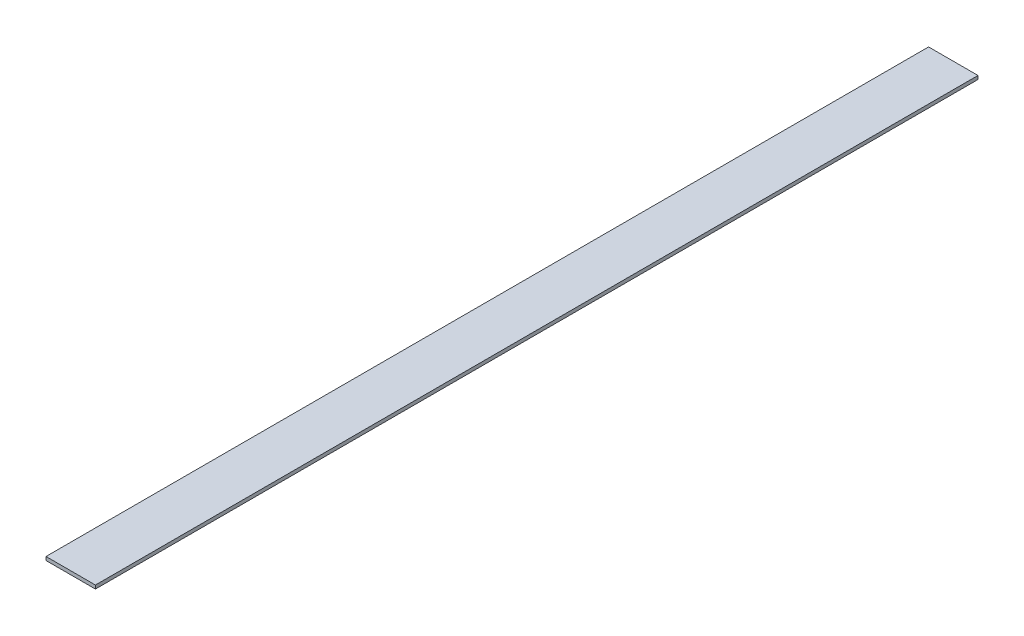
from build123d import *

# Parameters (mm, degrees)
SKETCH1_W           = 140
SKETCH1_H           = 10
BOSS_EXTRUDE1_DEPTH = 2500


with BuildPart() as part:
    # Sketch1 → Boss-Extrude1 (new body)
    with BuildSketch(Plane.XY):
        with Locations((70, -5)):
            Rectangle(SKETCH1_W, SKETCH1_H)
    extrude(amount=BOSS_EXTRUDE1_DEPTH)


solid = part.part
